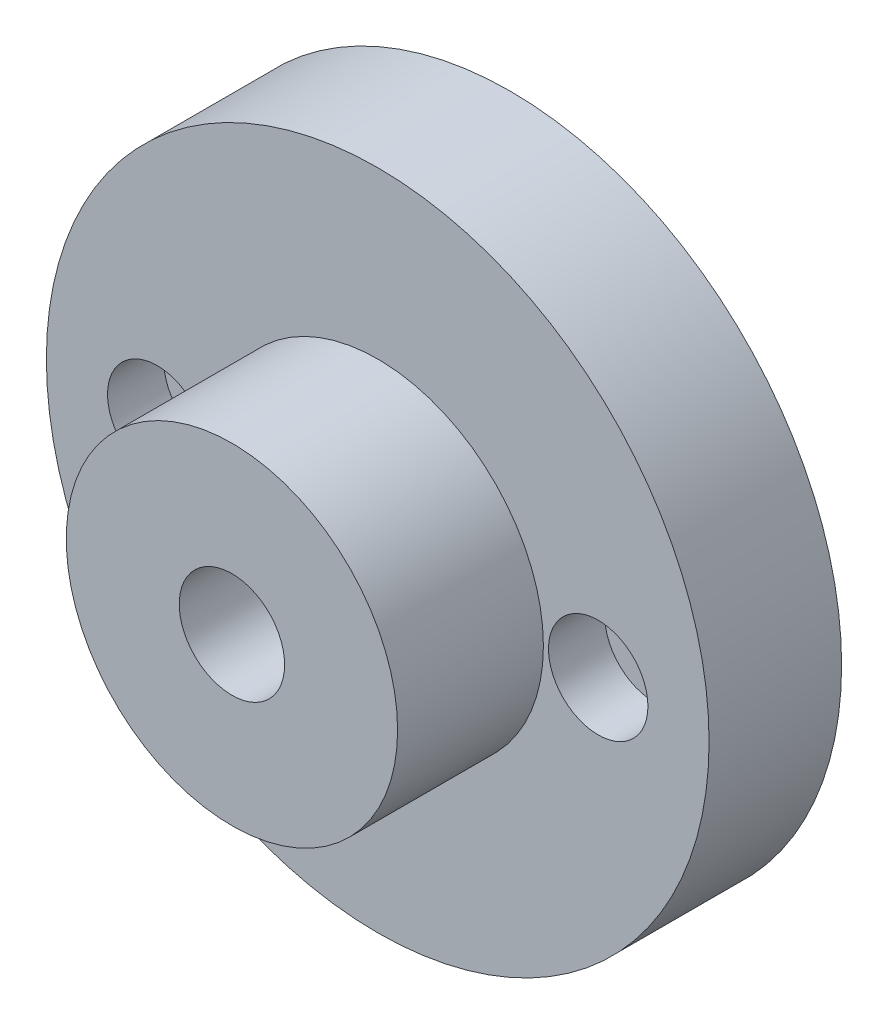
from build123d import *

# Parameters (mm, degrees)
SKETCH1_R                  = 12.7
BOSS_EXTRUDE1_DEPTH        = 5.08
SKETCH3_R                  = 6.35
BOSS_EXTRUDE2_DEPTH        = 5.588
SKETCH5_R                  = 2.0193
CUT_EXTRUDE1_DEPTH         = 5.588
F_50_0_07_DIAMETER_HOLE1_D = 1.778
SKETCH6_R                  = 1.905
CUT_EXTRUDE2_DEPTH         = 2.159


with BuildPart() as part:
    # Sketch1 → Boss-Extrude1 (new body)
    with BuildSketch(Plane.XY):
        Circle(SKETCH1_R)
    extrude(amount=BOSS_EXTRUDE1_DEPTH)

    # Sketch3 → Boss-Extrude2 (add)
    with BuildSketch(Plane.XY.offset(5.08)):
        Circle(SKETCH3_R)
    extrude(amount=BOSS_EXTRUDE2_DEPTH)

    # Sketch5 → Cut-Extrude1 (cut)
    with BuildSketch(Plane.XY.offset(10.668)):
        Circle(SKETCH5_R)
    extrude(amount=-CUT_EXTRUDE1_DEPTH, mode=Mode.SUBTRACT)

    # #50 (0.07) Diameter Hole1 (through all)
    with Locations(Plane.XY.offset(5.08)):
        with Locations((-8.45058, 0), (8.45058, 0)):
            Hole(F_50_0_07_DIAMETER_HOLE1_D / 2)

    # Sketch6 → Cut-Extrude2 (cut)
    with BuildSketch(Plane.XY.offset(5.08)):
        with Locations((-8.45058, 0)):
            Circle(SKETCH6_R)
        with Locations((8.45058, 0)):
            Circle(SKETCH6_R)
    extrude(amount=-CUT_EXTRUDE2_DEPTH, mode=Mode.SUBTRACT)

    # Cut-Extrude3 cone 1 section (through the dimple's axis) → Cut-Extrude3 (revolve, cut)
    with BuildSketch(Plane.YZ.offset(1.99898)):
        Polygon((0, 0), (1.905, 0), (0, 1.905), align=None)
    revolve(axis=Axis((1.99898, 0, 0), (0, 0, 1)), mode=Mode.SUBTRACT)


solid = part.part
